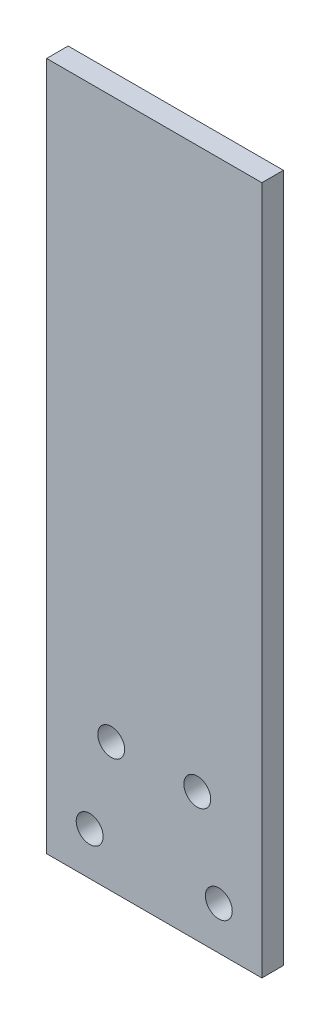
from build123d import *

# Parameters (mm, degrees)
SKETCH2_W                   = 63.5
SKETCH2_H                   = 203.2
BOSS_EXTRUDE1_DEPTH         = 3.175
TAP_DRILL_FOR_3_8_16_TAP1_D = 7.9375


with BuildPart() as part:
    # Sketch2 → Boss-Extrude1 (new, symmetric)
    with BuildSketch(Plane.XY):
        Rectangle(SKETCH2_W, SKETCH2_H)
    extrude(amount=BOSS_EXTRUDE1_DEPTH, both=True)

    # Tap Drill for 3/8-16 Tap1 (through all)
    with Locations(Plane.XY.offset(3.175)):
        with Locations((-12.7, -63.5), (12.7, -63.5), (-19.05, -88.9), (19.05, -88.9)):
            Hole(TAP_DRILL_FOR_3_8_16_TAP1_D / 2)


solid = part.part
